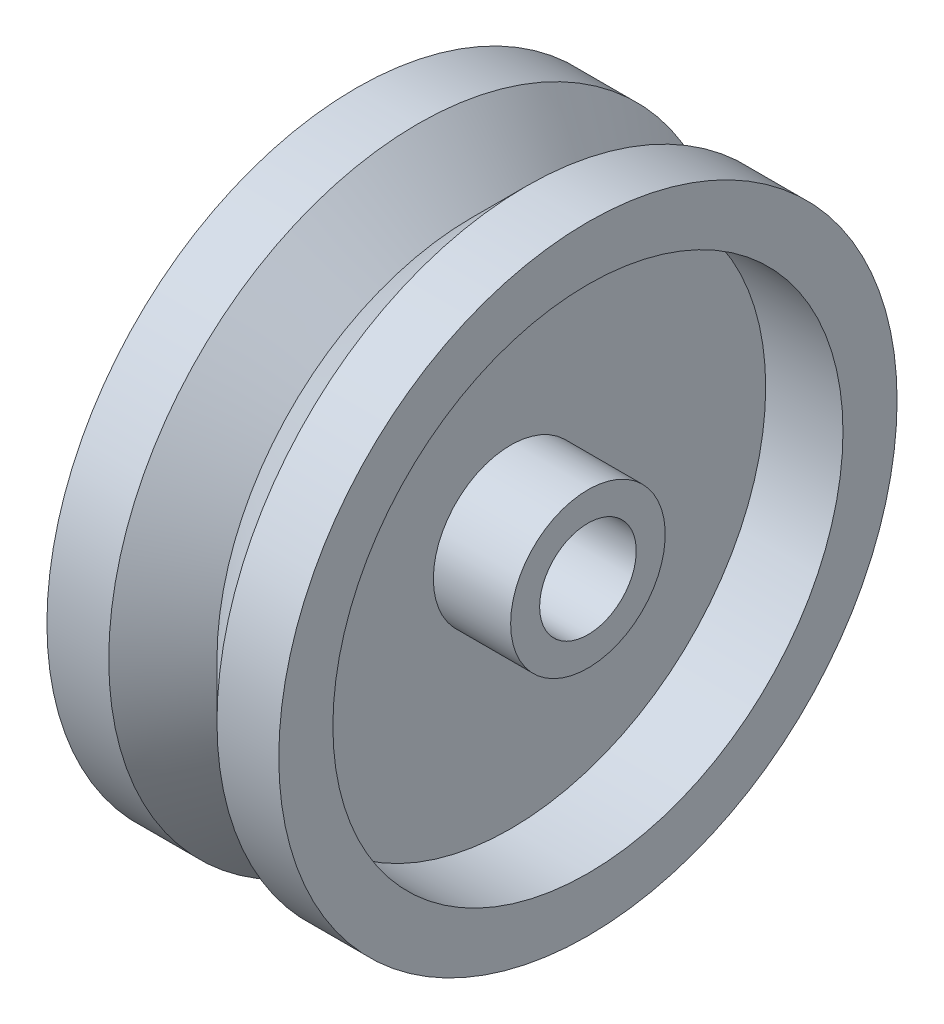
from build123d import *


with BuildPart() as part:
    # Sketch1 → Revolve1 (revolve)
    with BuildSketch(Plane.XY, mode=Mode.PRIVATE) as revolve1_sk:
        Polygon((0, 16.5), (3.5, 20), (7.5, 20), (7.5, 16.5), (2.5, 16.5), (2.5, 5), (7.5, 5), (7.5, 3.125), (-7.5, 3.125), (-7.5, 5), (-2.5, 5), (-2.5, 16.5), (-7.5, 16.5), (-7.5, 20), (-3.5, 20), align=None)
    revolve(revolve1_sk.sketch.rotate(Axis((0, 0, 0), (1, 0, 0)), 90), axis=Axis((0, 0, 0), (1, 0, 0)))


solid = part.part
